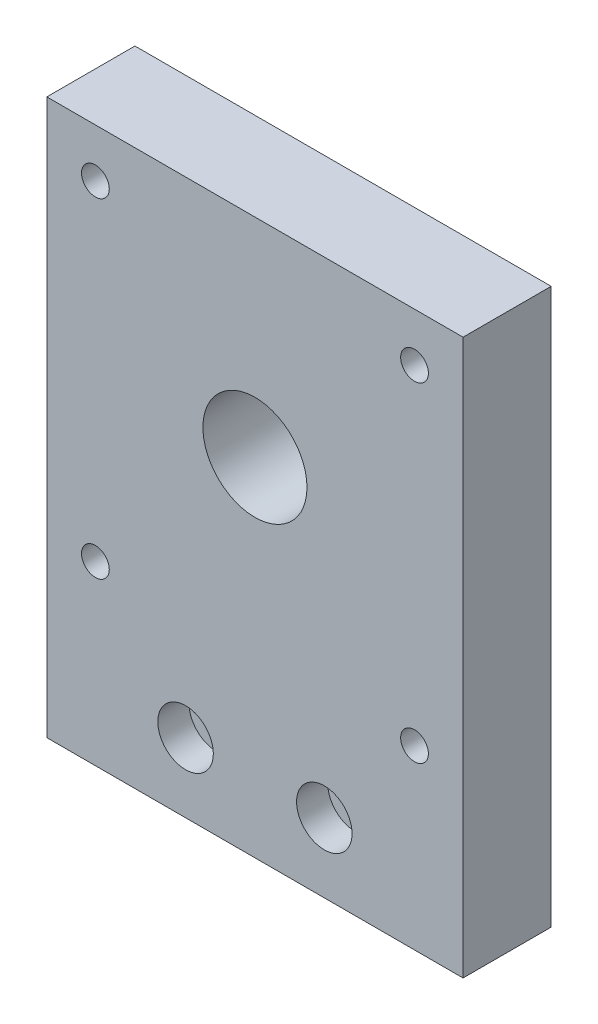
from build123d import *

# Parameters (mm, degrees)
CROQUIS1_W              = 51
CROQUIS1_H              = 80
CROQUIS1_R              = 2
CROQUIS1_R_2            = 7.5
SALIENTE_EXTRUIR1_DEPTH = 12.7
CROQUIS2_R              = 4
CORTAR_EXTRUIR1_DEPTH   = 4.5


with BuildPart() as part:
    # Croquis1 → Saliente-Extruir1 (new body)
    # profile 1 of 5: a face of its own
    with BuildSketch(Plane.XY):
        with BuildLine():
            ThreePointArc((-28.5, 37), (-27.621320344, 39.121320344), (-25.5, 40))
            Line((-25.5, 40), (-30, 40))
            Line((-30, 40), (-30, -40))
            Line((-30, -40), (-28.5, -40))
            Line((-28.5, -40), (-28.5, 37))
        make_face()
    # profile 2 of 5: a face of its own
    with BuildSketch(Plane.XY):
        with BuildLine():
            Line((-25.5, -40), (-25.5, 40))
            ThreePointArc((-25.5, 40), (-27.621320344, 39.121320344), (-28.5, 37))
            Line((-28.5, 37), (-28.5, -40))
            Line((-28.5, -40), (-25.5, -40))
        make_face()
    # profile 3 of 5: a face of its own
    with BuildSketch(Plane.XY):
        Rectangle(CROQUIS1_W, CROQUIS1_H)
        with Locations((-10, -30)):
            Circle(CROQUIS1_R, mode=Mode.SUBTRACT)
        with Locations((-23, -14.5)):
            Circle(CROQUIS1_R, mode=Mode.SUBTRACT)
        with Locations((10, -30)):
            Circle(CROQUIS1_R, mode=Mode.SUBTRACT)
        with Locations((23, -14.5)):
            Circle(CROQUIS1_R, mode=Mode.SUBTRACT)
        with Locations((-23, 33)):
            Circle(CROQUIS1_R, mode=Mode.SUBTRACT)
        with Locations((0, 10)):
            Circle(CROQUIS1_R_2, mode=Mode.SUBTRACT)
        with Locations((23, 33)):
            Circle(CROQUIS1_R, mode=Mode.SUBTRACT)
    # profile 4 of 5: a face of its own
    with BuildSketch(Plane.XY):
        with BuildLine():
            ThreePointArc((28.5, 37), (27.621320344, 39.121320344), (25.5, 40))
            Line((25.5, 40), (25.5, -40))
            Line((25.5, -40), (28.5, -40))
            Line((28.5, -40), (28.5, 37))
        make_face()
    # profile 5 of 5: a face of its own
    with BuildSketch(Plane.XY):
        with BuildLine():
            Line((30, 40), (25.5, 40))
            ThreePointArc((25.5, 40), (27.621320344, 39.121320344), (28.5, 37))
            Line((28.5, 37), (28.5, -40))
            Line((28.5, -40), (30, -40))
            Line((30, -40), (30, 40))
        make_face()
    extrude(amount=SALIENTE_EXTRUIR1_DEPTH)

    # Croquis2 → Cortar-Extruir1 (cut)
    with BuildSketch(Plane.XY.offset(12.7)):
        with Locations((-10, -30)):
            Circle(CROQUIS2_R)
        with Locations((10, -30)):
            Circle(CROQUIS2_R)
    extrude(amount=-CORTAR_EXTRUIR1_DEPTH, mode=Mode.SUBTRACT)


solid = part.part
